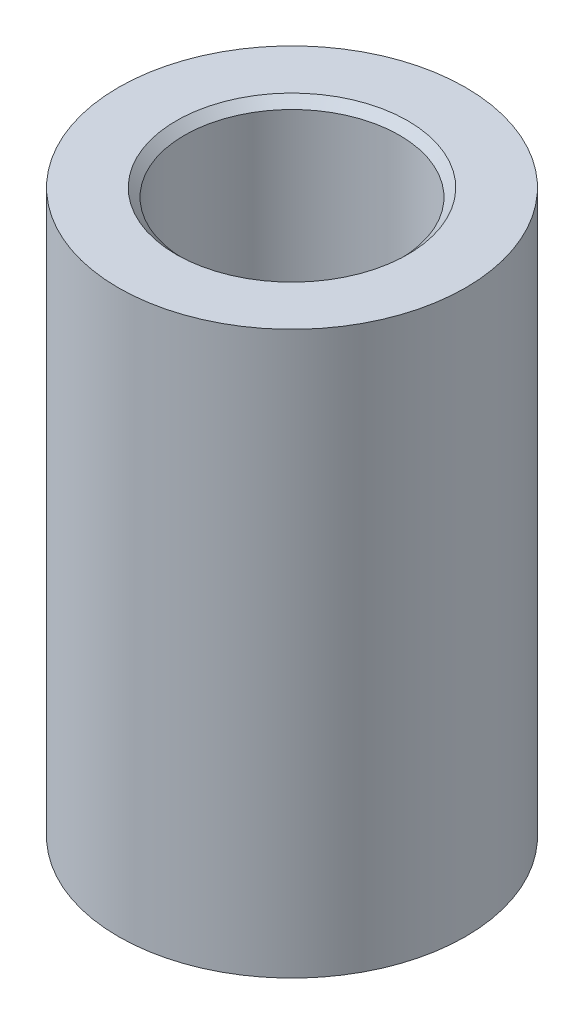
from build123d import *

# Parameters (mm, degrees)
SKETCH1_R           = 8.3375
SKETCH1_R_2         = 5.1625
BOSS_EXTRUDE1_DEPTH = 26.9875
CHAMFER1_SIZE       = 0.4


with BuildPart() as part:
    # Sketch1 → Boss-Extrude1 (new body)
    with BuildSketch(Plane(origin=(0, 0, 0), x_dir=(1, 0, 0), z_dir=(0, 1, 0))):
        with Locations(Location((0, 0, 0), (0, 0, 270))):
            Circle(SKETCH1_R)
        with Locations(Location((0, 0, 0), (0, 0, 270))):
            Circle(SKETCH1_R_2, mode=Mode.SUBTRACT)
    extrude(amount=BOSS_EXTRUDE1_DEPTH)

    # Chamfer1
    chamfer1_edges = [part.edges().sort_by_distance(p)[0] for p in [
        (0, 0, -5.1625),
        (0, 26.9875, -5.1625),
    ]]
    chamfer(chamfer1_edges, length=CHAMFER1_SIZE)


solid = part.part
